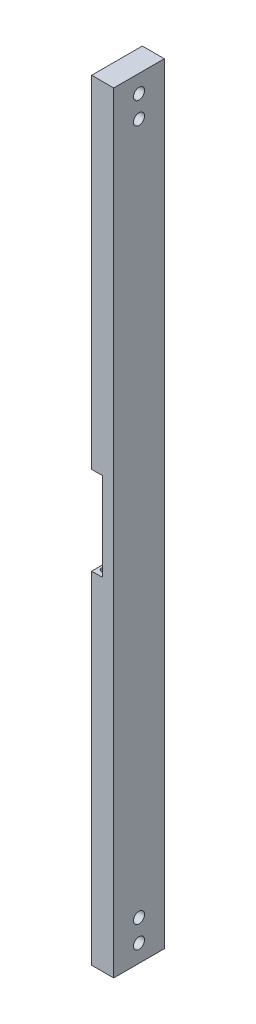
from build123d import *

# Parameters (mm, degrees)
SKETCH2_W               = 10
SKETCH2_H               = 23
BOSS_EXTRUDE1_DEPTH     = 175
SKETCH3_R               = 2.5
CUT_EXTRUDE1_DEPTH      = 176.662318099
SKETCH5_R               = 2.5
CUT_EXTRUDE2_DEPTH      = 176.662318099
SKETCH6_W               = 5
SKETCH6_H               = 40
CUT_EXTRUDE3_DEPTH      = 7
SKETCH7_R               = 1.5
CUT_EXTRUDE6_DEPTH      = 5
MIRROR2_COPY_1_SKETCH_R = 1.5
MIRROR2_COPY_1_DEPTH    = 5


with BuildPart() as part:
    # Sketch2 → Boss-Extrude1 (new, symmetric)
    with BuildSketch(Plane(origin=(0, 0, 0), x_dir=(1, 0, 0), z_dir=(0, 1, 0))):
        Rectangle(SKETCH2_W, SKETCH2_H)
    extrude(amount=BOSS_EXTRUDE1_DEPTH, both=True)

    # Sketch3 → Cut-Extrude1 (cut, through all)
    with BuildSketch(Plane(origin=(5, 0, 0), x_dir=(0, 0, -1), z_dir=(1, 0, 0))):
        with Locations((0, 167)):
            Circle(SKETCH3_R)
        with Locations((0, 157)):
            Circle(SKETCH3_R)
    extrude(amount=-CUT_EXTRUDE1_DEPTH, mode=Mode.SUBTRACT)

    # Sketch5 → Cut-Extrude2 (cut, through all)
    with BuildSketch(Plane(origin=(5, 0, 0), x_dir=(0, 0, -1), z_dir=(1, 0, 0))):
        with Locations((0, -167)):
            Circle(SKETCH5_R)
        with Locations((0, -157)):
            Circle(SKETCH5_R)
    extrude(amount=-CUT_EXTRUDE2_DEPTH, mode=Mode.SUBTRACT)

    # Sketch6 → Cut-Extrude3 (cut)
    with BuildSketch(Plane.XY.offset(11.5)):
        with Locations((-2.5, 0)):
            Rectangle(SKETCH6_W, SKETCH6_H)
    cut_extrude3 = extrude(amount=-CUT_EXTRUDE3_DEPTH, mode=Mode.SUBTRACT)

    # Sketch7 → Cut-Extrude6 (cut)
    with BuildSketch(Plane.XZ.offset(-20)):
        with Locations(Location((-2.5, 8, 0), (0, 0, 270))):
            Circle(SKETCH7_R)
    cut_extrude6 = extrude(amount=-CUT_EXTRUDE6_DEPTH, mode=Mode.SUBTRACT)

    # Mirror1: Cut-Extrude6 across plane
    add(cut_extrude6.mirror(Plane(origin=(0, 0, 0), x_dir=(0, 0, 1), z_dir=(0, -1, 0))), mode=Mode.SUBTRACT)

    # Mirror2: Cut-Extrude3, Cut-Extrude6 across plane
    add(cut_extrude3.mirror(Plane.XY), mode=Mode.SUBTRACT)
    add(cut_extrude6.mirror(Plane.XY), mode=Mode.SUBTRACT)

    # Mirror2 copy 1 sketch → Mirror2 copy 1 (cut)
    with BuildSketch(Plane(origin=(0, -20, 0), x_dir=(1, 0, 0), z_dir=(0, 1, 0))):
        with Locations(Location((-2.5, 8, 0), (0, 0, 270))):
            Circle(MIRROR2_COPY_1_SKETCH_R)
    extrude(amount=-MIRROR2_COPY_1_DEPTH, mode=Mode.SUBTRACT)


solid = part.part
